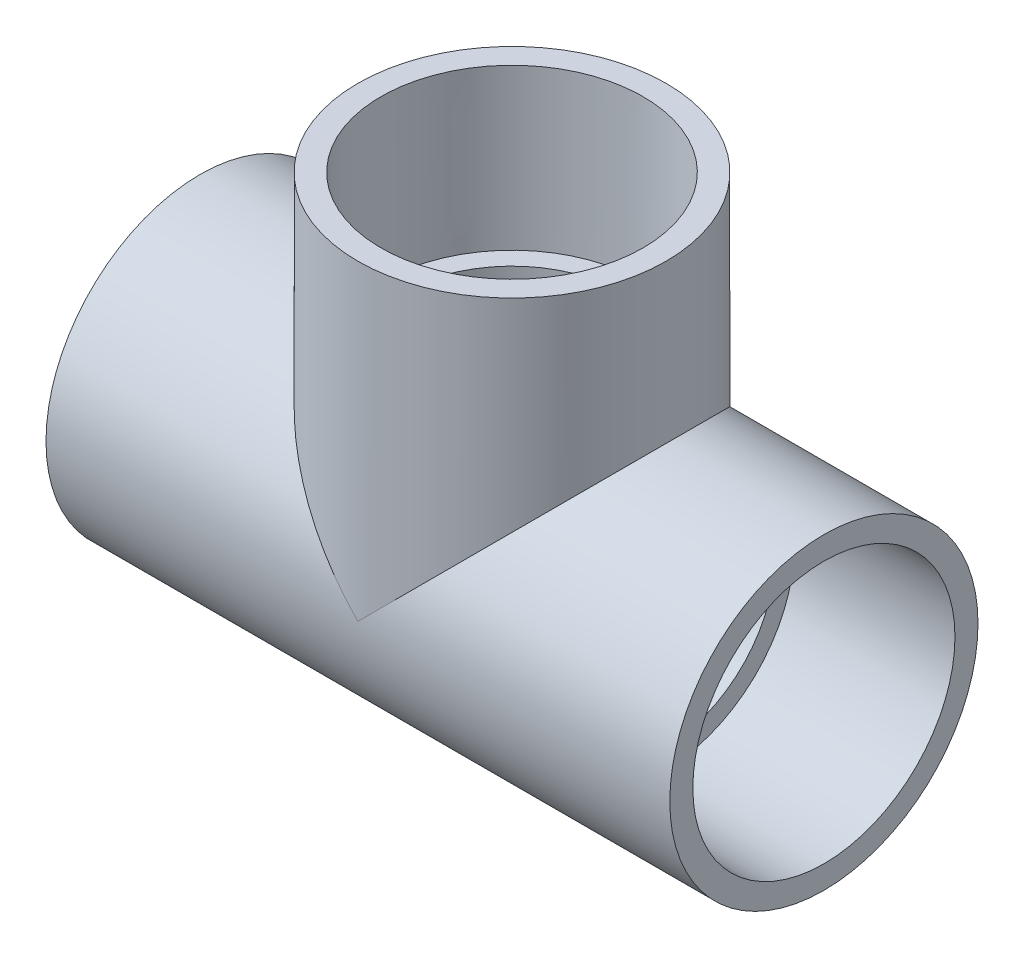
from build123d import *

# Parameters (mm, degrees)
BOSS_EXTRUDE1_START = 56.5404
SKETCH3_R           = 28.5496
BOSS_EXTRUDE1_DEPTH = 56.5404
SKETCH4_R           = 28.5496
BOSS_EXTRUDE2_DEPTH = 28.2702


with BuildPart() as part:
    # Sketch1 → Revolve1 (revolve)
    with BuildSketch(Plane.XY, mode=Mode.PRIVATE) as revolve1_sk:
        Polygon((-57.785, -28.5496), (-28.2702, -28.5496), (-28.2702, -24.0538), (-57.785, -24.2824), align=None)
        Polygon((57.785, -24.2824), (28.2702, -24.0538), (28.2702, -28.5496), (57.785, -28.5496), align=None)
    revolve(revolve1_sk.sketch.rotate(Axis((-57.785, 0, 0), (1, 0, 0)), 270), axis=Axis((-57.785, 0, 0), (1, 0, 0)))



with BuildPart() as body_2:
    # Sketch2 → Revolve2 (revolve)
    with BuildSketch(Plane.XY):
        Polygon((24.2824, 57.785), (24.0538, 28.2702), (28.5496, 28.2702), (28.5496, 57.785), align=None)
    revolve(axis=Axis((0, 0, 0), (0, 1, 0)))


with BuildPart() as part_1:
    add(part.part)

    add(body_2.part)  # Boss-Extrude1 merges body 2
    # Sketch3 → Boss-Extrude1 (add)
    with BuildSketch(Plane(origin=(-28.2702, 0, 0), x_dir=(0, 0, -1), z_dir=(1, 0, 0)).offset(BOSS_EXTRUDE1_START)):
        with Locations(Location((0, 0, 0), (0, 0, 180))):
            Circle(SKETCH3_R)
    extrude(amount=-BOSS_EXTRUDE1_DEPTH)

    # Sketch4 → Boss-Extrude2 (add)
    with BuildSketch(Plane.XZ.offset(-28.2702)):
        Circle(SKETCH4_R)
    extrude(amount=BOSS_EXTRUDE2_DEPTH)

    # Sketch5 → Cut-Revolve1 (revolve, cut)
    with BuildSketch(Plane.XY, mode=Mode.PRIVATE) as cut_revolve1_sk:
        Polygon((-57.785, -24.2824), (-28.2702, -24.0538), (-28.2702, -20.447), (28.2702, -20.447), (28.2702, -24.0538), (57.785, -24.2824), (57.785, 0), (-57.785, 0), align=None)
    revolve(cut_revolve1_sk.sketch.rotate(Axis((57.785, 0, 0), (-1, 0, 0)), 270), axis=Axis((57.785, 0, 0), (-1, 0, 0)), mode=Mode.SUBTRACT)

    # Sketch6 → Cut-Revolve2 (revolve, cut)
    with BuildSketch(Plane.XY):
        Polygon((24.2824, 57.785), (24.0538, 28.2702), (20.447, 28.2702), (20.447, 0), (0, 0), (0, 57.785), align=None)
    revolve(axis=Axis((0, 0, 0), (0, 1, 0)), mode=Mode.SUBTRACT)


solid = part_1.part
